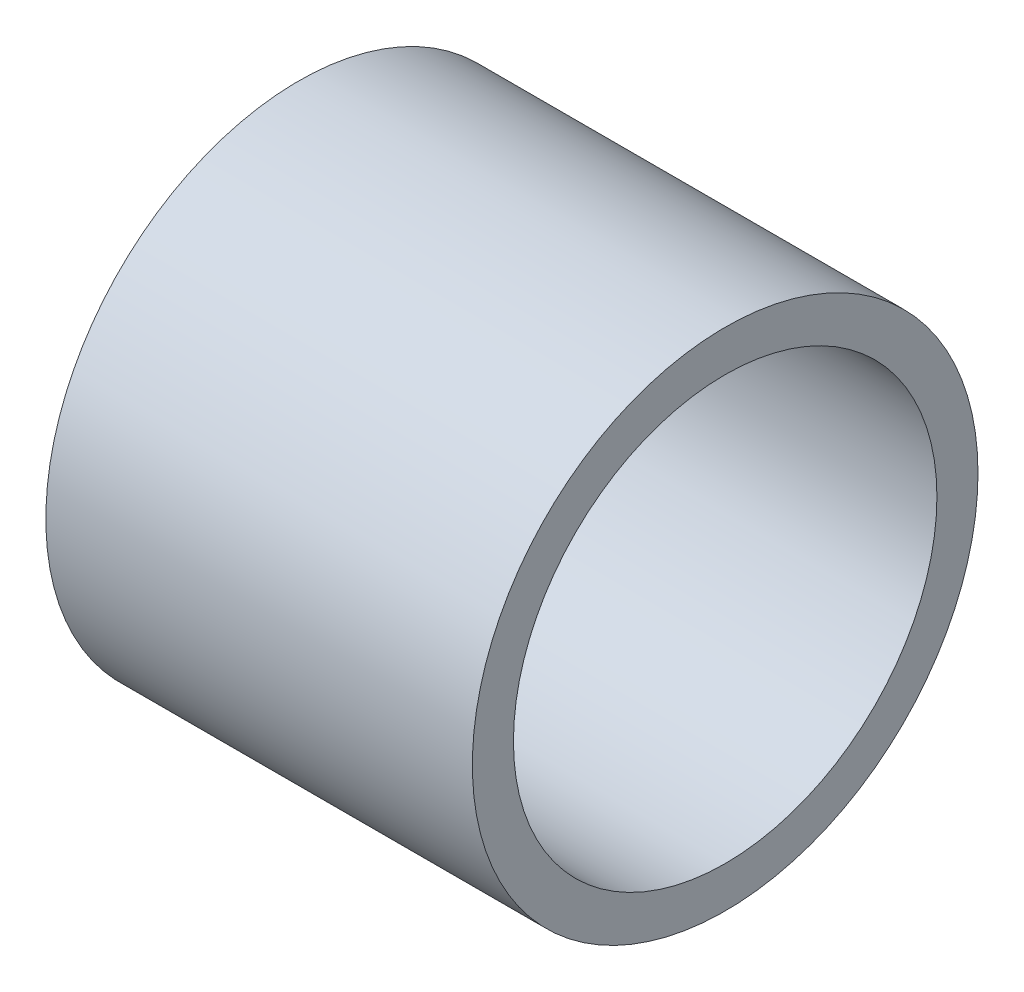
from build123d import *

# Parameters (mm, degrees)
SKETCH1_R      = 19.0754
SKETCH1_R_2    = 15.9766
EXTRUDE1_DEPTH = 32.1818


with BuildPart() as part:
    # Sketch1 → Extrude1 (new body)
    with BuildSketch(Plane(origin=(0, 0, 0), x_dir=(0, 0, -1), z_dir=(1, 0, 0))):
        Circle(SKETCH1_R)
        Circle(SKETCH1_R_2, mode=Mode.SUBTRACT)
    extrude(amount=EXTRUDE1_DEPTH)


solid = part.part
